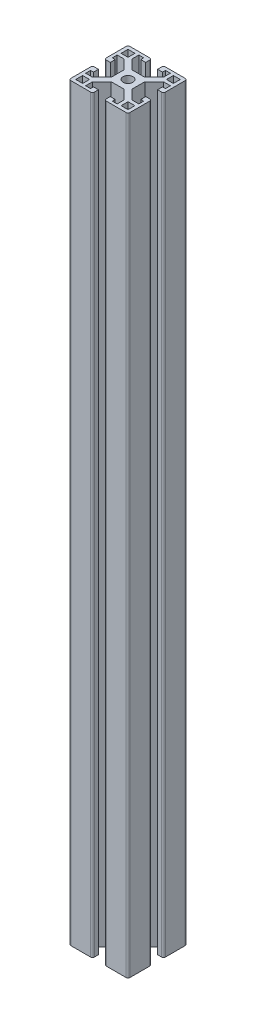
from build123d import *

# Parameters (mm, degrees)
SKETCH1_R           = 2.5
SKETCH1_W           = 3.5
SKETCH1_H           = 3.5
BOSS_EXTRUDE1_DEPTH = 380
FILLET1_R           = 1


with BuildPart() as part:
    # Sketch1 → Boss-Extrude1 (new body)
    with BuildSketch(Plane(origin=(0, 0, 0), x_dir=(1, 0, 0), z_dir=(0, 1, 0))):
        Polygon((-15, 7.5), (-15, -4.5), (-12, -4.5), (-12, -2), (-13.5, -2), (-13.5, 0.5), (-10, 0.5), (-5.25, -4.25), (-5.25, -10.75), (-10, -15.5), (-13.5, -15.5), (-13.5, -13), (-12, -13), (-12, -10.5), (-15, -10.5), (-15, -22.5), (-3, -22.5), (-3, -19.5), (-5.5, -19.5), (-5.5, -21), (-8, -21), (-8, -17.5), (-3.25, -12.75), (3.25, -12.75), (8, -17.5), (8, -21), (5.5, -21), (5.5, -19.5), (3, -19.5), (3, -22.5), (15, -22.5), (15, -10.5), (12, -10.5), (12, -13), (13.5, -13), (13.5, -15.5), (10, -15.5), (5.25, -10.75), (5.25, -4.25), (10, 0.5), (13.5, 0.5), (13.5, -2), (12, -2), (12, -4.5), (15, -4.5), (15, 7.5), (3, 7.5), (3, 4.5), (5.5, 4.5), (5.5, 6), (8, 6), (8, 2.5), (3.25, -2.25), (-3.25, -2.25), (-8, 2.5), (-8, 6), (-5.5, 6), (-5.5, 4.5), (-3, 4.5), (-3, 7.5), align=None)
        with Locations(Location((0, -7.5, 0), (0, 0, 270))):
            Circle(SKETCH1_R, mode=Mode.SUBTRACT)
        with Locations((-11.5, 4)):
            Rectangle(SKETCH1_W, SKETCH1_H, mode=Mode.SUBTRACT)
        with Locations((11.5, 4)):
            Rectangle(SKETCH1_W, SKETCH1_H, mode=Mode.SUBTRACT)
        with Locations((11.5, -19)):
            Rectangle(SKETCH1_W, SKETCH1_H, mode=Mode.SUBTRACT)
        with Locations((-11.5, -19)):
            Rectangle(SKETCH1_W, SKETCH1_H, mode=Mode.SUBTRACT)
    extrude(amount=-BOSS_EXTRUDE1_DEPTH)

    # Fillet1
    fillet1_edges = [part.edges().sort_by_distance(p)[0] for p in [
        (15, -190, 10.5),
        (15, -190, 22.5),
        (3, -190, 22.5),
        (-3, -190, 22.5),
        (-15, -190, 22.5),
        (-15, -190, 10.5),
        (-15, -190, 4.5),
        (-15, -190, -7.5),
        (-3, -190, -7.5),
        (3, -190, -7.5),
        (15, -190, -7.5),
        (15, -190, 4.5),
    ]]
    fillet(fillet1_edges, radius=FILLET1_R)


solid = part.part
